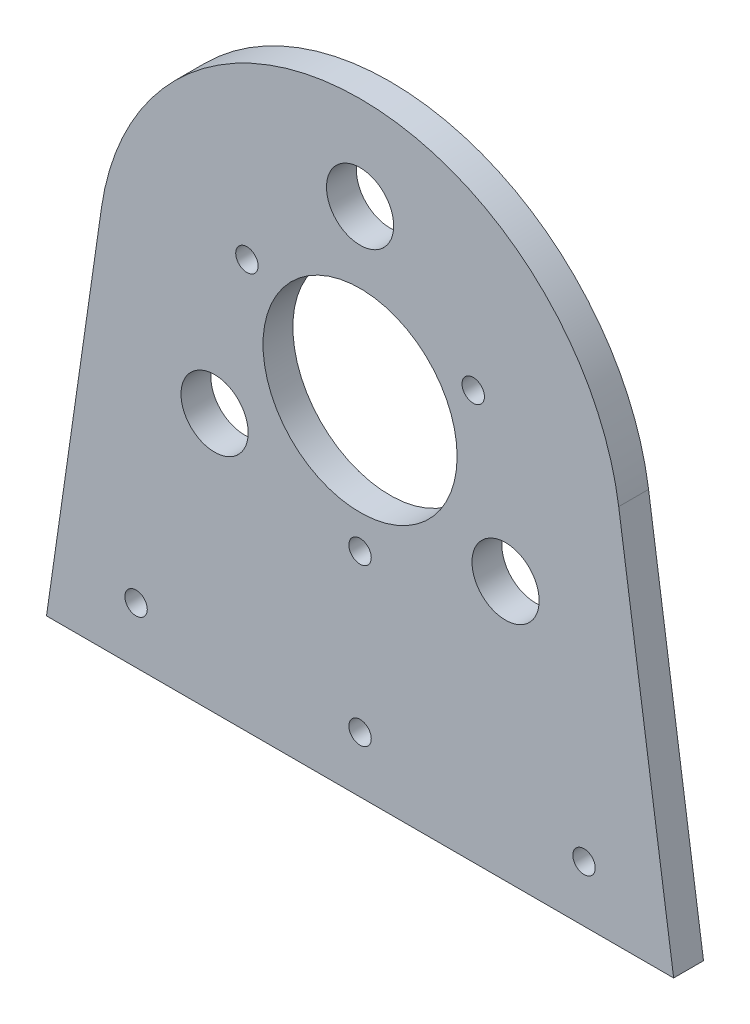
from build123d import *

# Parameters (mm, degrees)
SKETCH_1_R          = 13
EXTRUDE_1_DEPTH     = 4
SKETCH_2_R          = 4.5
CUT_EXTRUDE_1_DEPTH = 63.417946137
SKETCH_3_R          = 1.5
CUT_EXTRUDE_5_DEPTH = 4
SKETCH_4_R          = 1.5
CUT_EXTRUDE_6_DEPTH = 63.417946137


with BuildPart() as part:
    # 草图1 → 凸台-拉伸1 (new body)
    with BuildSketch(Plane.XY):
        with BuildLine():
            ThreePointArc((34.64123049, 4.998514795), (0, 35), (-34.64123049, 4.998514795))
            Line((-34.64123049, 4.998514795), (-42, -46))
            Line((-42, -46), (42, -46))
            Line((42, -46), (34.64123049, 4.998514795))
        make_face()
        Circle(SKETCH_1_R, mode=Mode.SUBTRACT)
    extrude(amount=EXTRUDE_1_DEPTH)

    # 草图2 → 切除-拉伸1 (cut, through all)
    with BuildSketch(Plane.XY.offset(4)):
        with Locations((0, 22.5)):
            Circle(SKETCH_2_R)
        with Locations((19.485571585, -11.25)):
            Circle(SKETCH_2_R)
        with Locations((-19.485571585, -11.25)):
            Circle(SKETCH_2_R)
    extrude(amount=-CUT_EXTRUDE_1_DEPTH, mode=Mode.SUBTRACT)

    # 草图3 → 切除-拉伸5 (cut)
    with BuildSketch(Plane.XY):
        with Locations((15.155444566, 8.75)):
            Circle(SKETCH_3_R)
        with Locations((0, -17.5)):
            Circle(SKETCH_3_R)
        with Locations((-15.155444566, 8.75)):
            Circle(SKETCH_3_R)
    extrude(amount=CUT_EXTRUDE_5_DEPTH, mode=Mode.SUBTRACT)

    # 草图4 → 切除-拉伸6 (cut, through all)
    with BuildSketch(Plane.XY.offset(4)):
        with Locations((0, -38.5)):
            Circle(SKETCH_4_R)
        with Locations((-30, -38.5)):
            Circle(SKETCH_4_R)
        with Locations(Location((30, -38.5, 0), (0, 0, 180))):
            Circle(SKETCH_4_R)
    extrude(amount=-CUT_EXTRUDE_6_DEPTH, mode=Mode.SUBTRACT)


solid = part.part
